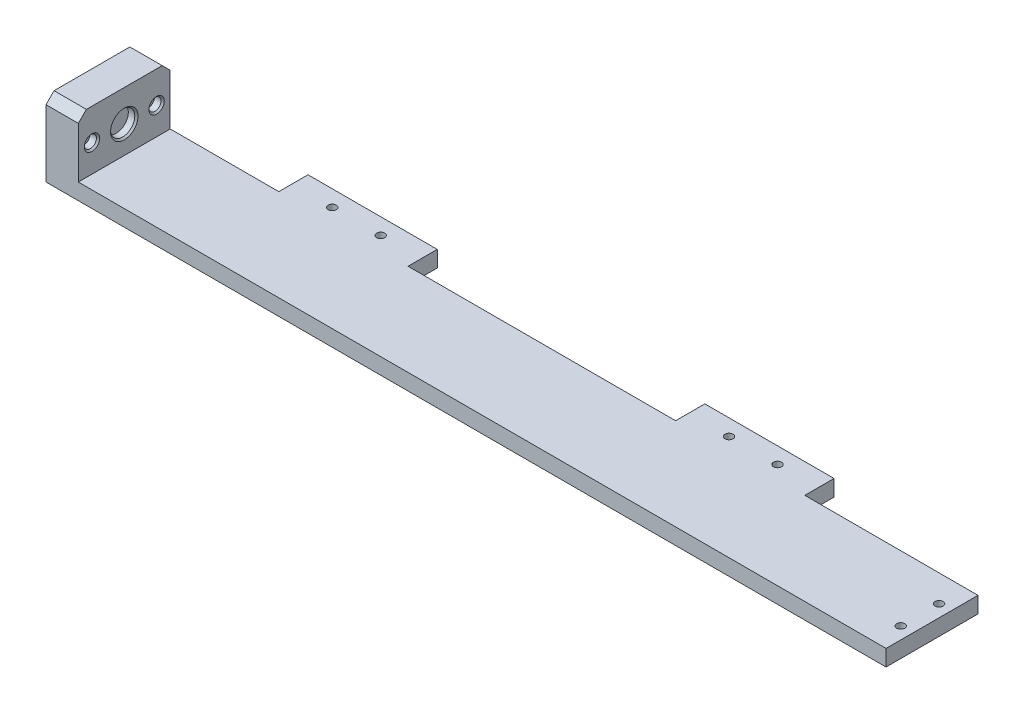
from build123d import *

# Parameters (mm, degrees)
SKETCH_1_W               = 211.216150174
SKETCH_1_H               = 56.943071366
EXTRUDE_1_DEPTH          = 20
SKETCH_2_W               = 1000
SKETCH_2_H               = 113.81790299
EXTRUDE_2_DEPTH          = 20
SKETCH_3_W               = 160
SKETCH_3_H               = 36.18209701
EXTRUDE_3_DEPTH          = 20
SKETCH_4_W               = 160
SKETCH_4_H               = 36.18209701
EXTRUDE_4_DEPTH          = 20
SKETCH_5_W               = 40
SKETCH_5_H               = 72.930561876
EXTRUDE_5_DEPTH          = 113.817902989
CUT_EXTRUDE_1_DEPTH      = 969.969572609
CUT_EXTRUDE_1_DEPTH_BACK = 10
SKETCH_6_R               = 15
SKETCH_6_R_2             = 7.5
SKETCH_7_W               = 113.81790299
SKETCH_7_H               = 20
EXTRUDE_6_DEPTH          = 40
CUT_EXTRUDE_2_DEPTH      = 553.797259551
CUT_EXTRUDE_2_DEPTH_BACK = 553.797259551
SKETCH_8_R               = 5
CHAMFER_1_SIZE           = 10
CHAMFER_2_SIZE           = 2
SKETCH_9_R               = 5
CUT_EXTRUDE_3_DEPTH      = 300


with BuildPart() as part:
    # 草图1 → 凸台-拉伸1 (new body)
    with BuildSketch(Plane(origin=(0, 0, 0), x_dir=(1, 0, 0), z_dir=(0, 1, 0))):
        Rectangle(SKETCH_1_W, SKETCH_1_H)
    extrude(amount=EXTRUDE_1_DEPTH)

    # 草图2 → 凸台-拉伸2 (add)
    with BuildSketch(Plane(origin=(0, 20, 0), x_dir=(1, 0, 0), z_dir=(0, 1, 0))):
        Rectangle(SKETCH_2_W, SKETCH_2_H)
    extrude(amount=-EXTRUDE_2_DEPTH)

    # 草图3 → 凸台-拉伸3 (add)
    with BuildSketch(Plane(origin=(0, 20, 0), x_dir=(1, 0, 0), z_dir=(0, 1, 0))):
        with Locations((-245.625, 75)):
            Rectangle(SKETCH_3_W, SKETCH_3_H)
    extrude(amount=-EXTRUDE_3_DEPTH)

    # 草图4 → 凸台-拉伸4 (add)
    with BuildSketch(Plane(origin=(0, 20, 0), x_dir=(1, 0, 0), z_dir=(0, 1, 0))):
        with Locations((245.625, 75)):
            Rectangle(SKETCH_4_W, SKETCH_4_H)
    extrude(amount=-EXTRUDE_4_DEPTH)

    # 草图5 → 凸台-拉伸5 (add)
    with BuildSketch(Plane.XY.offset(56.908951495)):
        with Locations((-480, 56.465280938)):
            Rectangle(SKETCH_5_W, SKETCH_5_H)
    extrude(amount=-EXTRUDE_5_DEPTH)

    # 草图6 → 切除-拉伸1 (cut, two sides: drawn at the far end of the back side and taken through both)
    with BuildSketch(Plane(origin=(-460, 0, 0), x_dir=(0, 0, -1), z_dir=(1, 0, 0)).offset(-CUT_EXTRUDE_1_DEPTH_BACK)):
        with Locations((0, 53.825309314)):
            Circle(SKETCH_6_R)
        with Locations((40, 53.825309314)):
            Circle(SKETCH_6_R_2)
        with Locations((-40, 53.825309314)):
            Circle(SKETCH_6_R_2)
    extrude(amount=CUT_EXTRUDE_1_DEPTH + CUT_EXTRUDE_1_DEPTH_BACK, mode=Mode.SUBTRACT)

    # 草图7 → 凸台-拉伸6 (add)
    with BuildSketch(Plane(origin=(500, 0, 0), x_dir=(0, 0, -1), z_dir=(1, 0, 0))):
        with Locations((0, 10)):
            Rectangle(SKETCH_7_W, SKETCH_7_H)
    extrude(amount=EXTRUDE_6_DEPTH)

    # 草图8 → 切除-拉伸2 (cut, two sides: drawn at the far end of the back side and taken through both)
    with BuildSketch(Plane(origin=(0, 20, 0), x_dir=(1, 0, 0), z_dir=(0, 1, 0)).offset(-CUT_EXTRUDE_2_DEPTH_BACK)):
        with Locations(Location((525, 23.75, 0), (0, 0, 270))):
            Circle(SKETCH_8_R)
        with Locations(Location((525, -23.75, 0), (0, 0, 270))):
            Circle(SKETCH_8_R)
    extrude(amount=CUT_EXTRUDE_2_DEPTH + CUT_EXTRUDE_2_DEPTH_BACK, mode=Mode.SUBTRACT)

    # 倒角1
    chamfer_1_edges = [part.edges().sort_by_distance(p)[0] for p in [
        (-480, 92.930561876, 56.908951495),
        (-480, 92.930561876, -56.908951494),
    ]]
    chamfer(chamfer_1_edges, length=CHAMFER_1_SIZE)

    # 倒角2
    chamfer_2_edges = [part.edges().sort_by_distance(p)[0] for p in [
        (-460, 53.825309314, 47.5),
        (-460, 53.825309314, -32.5),
        (-460, 53.825309314, 15),
    ]]
    chamfer(chamfer_2_edges, length=CHAMFER_2_SIZE)

    # 草图9 → 切除-拉伸3 (cut)
    with BuildSketch(Plane(origin=(0, 20, 0), x_dir=(1, 0, 0), z_dir=(0, 1, 0))):
        with Locations(Location((-275.625, 73.091048505, 0), (0, 0, 270))):
            Circle(SKETCH_9_R)
        with Locations(Location((-215.625, 73.091048505, 0), (0, 0, 270))):
            Circle(SKETCH_9_R)
        with Locations(Location((215.625, 73.091048505, 0), (0, 0, 270))):
            Circle(SKETCH_9_R)
        with Locations(Location((275.625, 73.091048505, 0), (0, 0, 270))):
            Circle(SKETCH_9_R)
    extrude(amount=-CUT_EXTRUDE_3_DEPTH, mode=Mode.SUBTRACT)


solid = part.part
